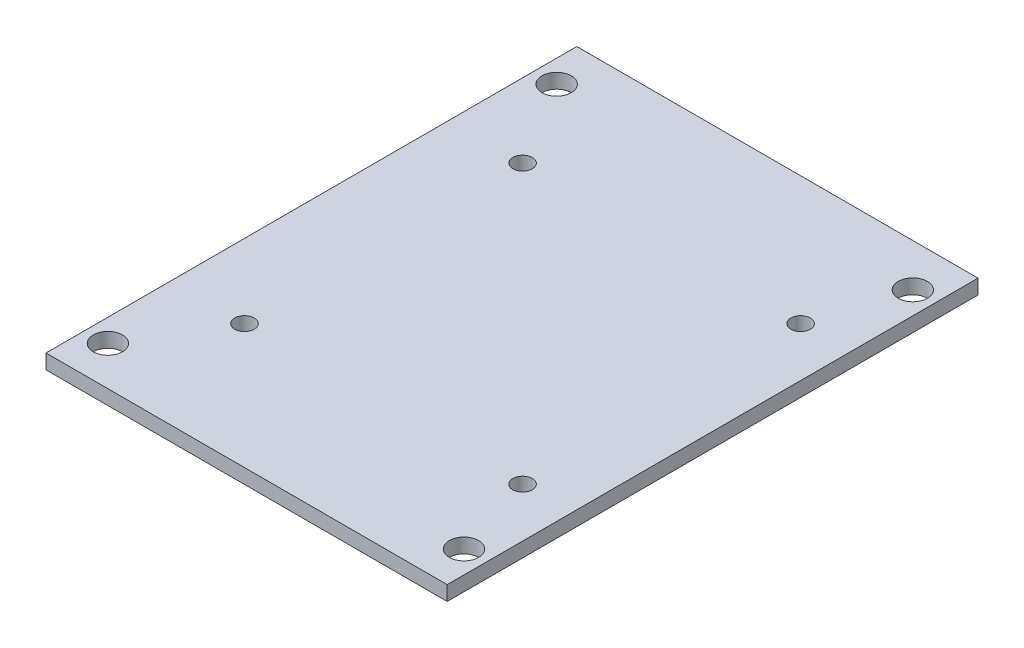
from build123d import *

# Parameters (mm, degrees)
SKETCH_1_W      = 41.123
SKETCH_1_H      = 54.407
SKETCH_1_R      = 1
SKETCH_1_R_2    = 1.5
EXTRUDE_1_DEPTH = 1.5


with BuildPart() as part:
    # 草图1 → 凸台-拉伸1 (new body)
    with BuildSketch(Plane(origin=(0, 0, 0), x_dir=(1, 0, 0), z_dir=(0, 1, 0))):
        with Locations((-1.2575, 0.1775)):
            Rectangle(SKETCH_1_W, SKETCH_1_H)
        with Locations(Location((-14.25, 14.25, 0), (0, 0, 270))):
            Circle(SKETCH_1_R, mode=Mode.SUBTRACT)
        with Locations(Location((14.25, 14.25, 0), (0, 0, 270))):
            Circle(SKETCH_1_R, mode=Mode.SUBTRACT)
        with Locations(Location((14.25, -14.25, 0), (0, 0, 270))):
            Circle(SKETCH_1_R, mode=Mode.SUBTRACT)
        with Locations(Location((-14.25, -14.25, 0), (0, 0, 270))):
            Circle(SKETCH_1_R, mode=Mode.SUBTRACT)
        with Locations(Location((-19.5, 23, 0), (0, 0, 270))):
            Circle(SKETCH_1_R_2, mode=Mode.SUBTRACT)
        with Locations(Location((17, 23, 0), (0, 0, 270))):
            Circle(SKETCH_1_R_2, mode=Mode.SUBTRACT)
        with Locations(Location((17, -23, 0), (0, 0, 270))):
            Circle(SKETCH_1_R_2, mode=Mode.SUBTRACT)
        with Locations(Location((-19.5, -23, 0), (0, 0, 270))):
            Circle(SKETCH_1_R_2, mode=Mode.SUBTRACT)
    extrude(amount=EXTRUDE_1_DEPTH)


solid = part.part
